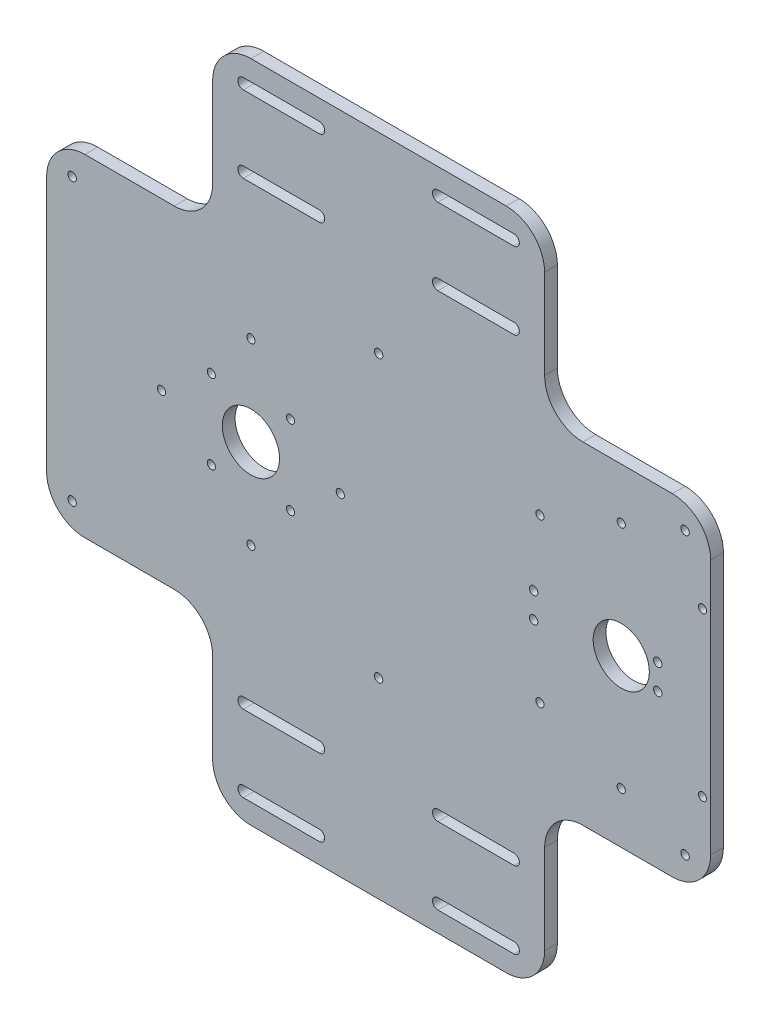
from build123d import *

# Parameters (mm, degrees)
EXTRUDE_1_DEPTH     = 5
CUT_EXTRUDE_1_DEPTH = 5
SKETCH_3_R          = 1.65
CUT_EXTRUDE_2_DEPTH = 10
SKETCH_4_R          = 11.2
SKETCH_4_R_2        = 11
SKETCH_4_R_3        = 1.65
SKETCH_4_R_4        = 1.6
CUT_EXTRUDE_3_DEPTH = 10
FILLET_1_R          = 15


with BuildPart() as part:
    # 草图1 → 凸台-拉伸1 (new body)
    with BuildSketch(Plane.XY):
        Polygon((65, 65), (65, 0), (195, 0), (195, 65), (260, 65), (260, 195), (195, 195), (195, 260), (65, 260), (65, 195), (0, 195), (0, 65), align=None)
    extrude(amount=EXTRUDE_1_DEPTH)

    # 草图2 → 切除-拉伸1 (cut)
    with BuildSketch(Plane(origin=(0, 0, 0), x_dir=(-1, 0, 0), z_dir=(0, 0, -1))):
        with BuildLine():
            Line((-106.8, 12.1), (-77, 12.1))
            ThreePointArc((-77, 12.1), (-74.9, 10), (-77, 7.9))
            Line((-77, 7.9), (-106.8, 7.9))
            ThreePointArc((-106.8, 7.9), (-108.9, 10), (-106.8, 12.1))
        make_face()
        with BuildLine():
            Line((-106.8, 42.1), (-77, 42.1))
            ThreePointArc((-77, 42.1), (-74.9, 40), (-77, 37.9))
            Line((-77, 37.9), (-106.8, 37.9))
            ThreePointArc((-106.8, 37.9), (-108.9, 40), (-106.8, 42.1))
        make_face()
        with BuildLine():
            Line((-153.2, 12.1), (-183, 12.1))
            ThreePointArc((-183, 12.1), (-185.1, 10), (-183, 7.9))
            Line((-183, 7.9), (-153.2, 7.9))
            ThreePointArc((-153.2, 7.9), (-151.1, 10), (-153.2, 12.1))
        make_face()
        with BuildLine():
            Line((-153.2, 42.1), (-183, 42.1))
            ThreePointArc((-183, 42.1), (-185.1, 40), (-183, 37.9))
            Line((-183, 37.9), (-153.2, 37.9))
            ThreePointArc((-153.2, 37.9), (-151.1, 40), (-153.2, 42.1))
        make_face()
        with BuildLine():
            Line((-106.8, 247.9), (-77, 247.9))
            ThreePointArc((-77, 247.9), (-74.9, 250), (-77, 252.1))
            Line((-77, 252.1), (-106.8, 252.1))
            ThreePointArc((-106.8, 252.1), (-108.9, 250), (-106.8, 247.9))
        make_face()
        with BuildLine():
            Line((-106.8, 217.9), (-77, 217.9))
            ThreePointArc((-77, 217.9), (-74.9, 220), (-77, 222.1))
            Line((-77, 222.1), (-106.8, 222.1))
            ThreePointArc((-106.8, 222.1), (-108.9, 220), (-106.8, 217.9))
        make_face()
        with BuildLine():
            Line((-153.2, 247.9), (-183, 247.9))
            ThreePointArc((-183, 247.9), (-185.1, 250), (-183, 252.1))
            Line((-183, 252.1), (-153.2, 252.1))
            ThreePointArc((-153.2, 252.1), (-151.1, 250), (-153.2, 247.9))
        make_face()
        with BuildLine():
            Line((-153.2, 217.9), (-183, 217.9))
            ThreePointArc((-183, 217.9), (-185.1, 220), (-183, 222.1))
            Line((-183, 222.1), (-153.2, 222.1))
            ThreePointArc((-153.2, 222.1), (-151.1, 220), (-153.2, 217.9))
        make_face()
    extrude(amount=-CUT_EXTRUDE_1_DEPTH, mode=Mode.SUBTRACT)

    # 草图3 → 切除-拉伸2 (cut)
    with BuildSketch(Plane.XY.offset(5)):
        with Locations((250, 185)):
            Circle(SKETCH_3_R)
        with Locations((250, 75)):
            Circle(SKETCH_3_R)
        with Locations((10, 75)):
            Circle(SKETCH_3_R)
        with Locations((10, 185)):
            Circle(SKETCH_3_R)
        with Locations((130, 75)):
            Circle(SKETCH_3_R)
        with Locations((130, 185)):
            Circle(SKETCH_3_R)
    extrude(amount=-CUT_EXTRUDE_2_DEPTH, mode=Mode.SUBTRACT)

    # 草图4 → 切除-拉伸3 (cut)
    with BuildSketch(Plane.XY.offset(5)):
        with Locations((80, 130)):
            Circle(SKETCH_4_R)
        with Locations((225, 130)):
            Circle(SKETCH_4_R_2)
        with Locations((190.7, 134.95)):
            Circle(SKETCH_4_R_3)
        with Locations((190.7, 125.05)):
            Circle(SKETCH_4_R_3)
        with Locations((239.3, 134.95)):
            Circle(SKETCH_4_R_3)
        with Locations((239.3, 125.05)):
            Circle(SKETCH_4_R_3)
        with Locations((64.5, 145.5)):
            Circle(SKETCH_4_R_4)
        with Locations((95.5, 145.5)):
            Circle(SKETCH_4_R_4)
        with Locations((95.5, 114.5)):
            Circle(SKETCH_4_R_4)
        with Locations((64.5, 114.5)):
            Circle(SKETCH_4_R_4)
        with Locations((193.180194847, 161.819805153)):
            Circle(SKETCH_4_R_4)
        with Locations((193.180194847, 98.180194847)):
            Circle(SKETCH_4_R_4)
        with Locations((115, 130)):
            Circle(SKETCH_4_R_4)
        with Locations((80, 95)):
            Circle(SKETCH_4_R_4)
        with Locations((45, 130)):
            Circle(SKETCH_4_R_4)
        with Locations((80, 165)):
            Circle(SKETCH_4_R_4)
        with Locations((225, 175)):
            Circle(SKETCH_4_R_4)
        with Locations((225, 85)):
            Circle(SKETCH_4_R_4)
        with Locations((256.819805153, 98.180194847)):
            Circle(SKETCH_4_R_4)
        with Locations((256.819805153, 161.819805153)):
            Circle(SKETCH_4_R_4)
    extrude(amount=-CUT_EXTRUDE_3_DEPTH, mode=Mode.SUBTRACT)

    # 圆角1
    fillet_1_edges = [part.edges().sort_by_distance(p)[0] for p in [
        (65, 0, 2.5),
        (65, 65, 2.5),
        (0, 65, 2.5),
        (0, 195, 2.5),
        (65, 195, 2.5),
        (65, 260, 2.5),
        (195, 260, 2.5),
        (195, 195, 2.5),
        (260, 195, 2.5),
        (260, 65, 2.5),
        (195, 65, 2.5),
        (195, 0, 2.5),
    ]]
    fillet(fillet_1_edges, radius=FILLET_1_R)


solid = part.part
